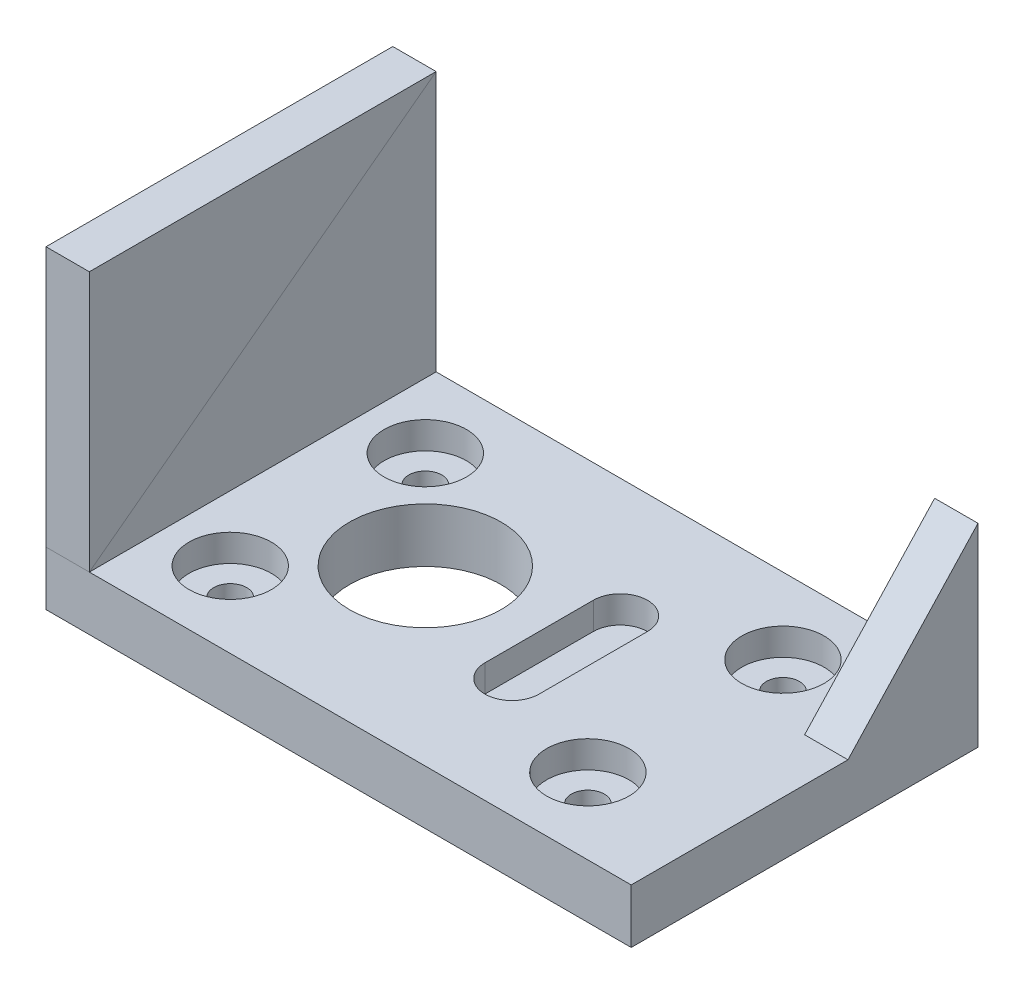
from build123d import *

# Parameters (mm, degrees)
SKETCH2_W           = 46
SKETCH2_H           = 32
SKETCH2_R           = 1.525
SKETCH2_R_2         = 7
BOSS_EXTRUDE1_DEPTH = 5
SKETCH3_R           = 3.8
CUT_EXTRUDE1_DEPTH  = 2.5
BOSS_EXTRUDE2_DEPTH = 87.8
BOSS_EXTRUDE3_START = 82.8
SKETCH2_2_W         = 46
SKETCH2_2_H         = 32
SKETCH2_2_R         = 1.525
SKETCH2_2_R_2       = 7
BOSS_EXTRUDE3_DEPTH = 5
CUT_EXTRUDE2_START  = 80.3
SKETCH3_3_R         = 3.8
CUT_EXTRUDE2_DEPTH  = 2.5
CUT_EXTRUDE3_DEPTH  = 5
CUT_EXTRUDE4_DEPTH  = 5
CUT_EXTRUDE5_DEPTH  = 66
BOSS_EXTRUDE5_DEPTH = 4


with BuildPart() as part:
    # Sketch2 → Boss-Extrude1 (new body)
    with BuildSketch(Plane(origin=(0, 0, 0), x_dir=(1, 0, 0), z_dir=(0, 1, 0))):
        Rectangle(SKETCH2_W, SKETCH2_H)
        with Locations(Location((-17, 9, 0), (0, 0, 270))):
            Circle(SKETCH2_R, mode=Mode.SUBTRACT)
        with Locations(Location((-17, -9, 0), (0, 0, 270))):
            Circle(SKETCH2_R, mode=Mode.SUBTRACT)
        with Locations(Location((16, -9, 0), (0, 0, 270))):
            Circle(SKETCH2_R, mode=Mode.SUBTRACT)
        with Locations(Location((16, 9, 0), (0, 0, 270))):
            Circle(SKETCH2_R, mode=Mode.SUBTRACT)
        with Locations(Location((-8, 0, 0), (0, 0, 270))):
            Circle(SKETCH2_R_2, mode=Mode.SUBTRACT)
    extrude(amount=BOSS_EXTRUDE1_DEPTH)

    # Sketch3 → Cut-Extrude1 (cut)
    with BuildSketch(Plane(origin=(0, 5, 0), x_dir=(1, 0, 0), z_dir=(0, 1, 0))):
        with Locations(Location((-17, 9, 0), (0, 0, 270))):
            Circle(SKETCH3_R)
        with Locations(Location((-17, -9, 0), (0, 0, 270))):
            Circle(SKETCH3_R)
        with Locations(Location((16, -9, 0), (0, 0, 270))):
            Circle(SKETCH3_R)
        with Locations(Location((16, 9, 0), (0, 0, 270))):
            Circle(SKETCH3_R)
        with BuildLine():
            Line((7.5, 5), (7.5, -5))
            ThreePointArc((7.5, -5), (5, -7.5), (2.5, -5))
            Line((2.5, -5), (2.5, 5))
            ThreePointArc((2.5, 5), (5, 7.5), (7.5, 5))
        make_face()
    extrude(amount=-CUT_EXTRUDE1_DEPTH, mode=Mode.SUBTRACT)

    # Sketch4 → Boss-Extrude2 (add)
    with BuildSketch(Plane(origin=(0, 0, 0), x_dir=(-1, 0, 0), z_dir=(0, -1, 0))):
        Polygon((23, 16), (-23, 16), (-23, -16), (-27, -16), (-27, 18.5), (27, 18.5), (27, -16), (23, -16), align=None)
    extrude(amount=-BOSS_EXTRUDE2_DEPTH)

    # Sketch2<2> → Boss-Extrude3 (add)
    with BuildSketch(Plane(origin=(0, 0, 0), x_dir=(1, 0, 0), z_dir=(0, 1, 0)).offset(BOSS_EXTRUDE3_START)):
        Rectangle(SKETCH2_2_W, SKETCH2_2_H)
        with Locations(Location((-17, 9, 0), (0, 0, 270))):
            Circle(SKETCH2_2_R, mode=Mode.SUBTRACT)
        with Locations(Location((-17, -9, 0), (0, 0, 270))):
            Circle(SKETCH2_2_R, mode=Mode.SUBTRACT)
        with Locations(Location((16, -9, 0), (0, 0, 270))):
            Circle(SKETCH2_2_R, mode=Mode.SUBTRACT)
        with Locations(Location((16, 9, 0), (0, 0, 270))):
            Circle(SKETCH2_2_R, mode=Mode.SUBTRACT)
        with Locations(Location((-8, 0, 0), (0, 0, 270))):
            Circle(SKETCH2_2_R_2, mode=Mode.SUBTRACT)
    extrude(amount=BOSS_EXTRUDE3_DEPTH)

    # Sketch3<3> → Cut-Extrude2 (cut)
    with BuildSketch(Plane(origin=(0, 5, 0), x_dir=(1, 0, 0), z_dir=(0, 1, 0)).offset(CUT_EXTRUDE2_START)):
        with Locations(Location((-17, 9, 0), (0, 0, 270))):
            Circle(SKETCH3_3_R)
        with Locations(Location((-17, -9, 0), (0, 0, 270))):
            Circle(SKETCH3_3_R)
        with Locations(Location((16, -9, 0), (0, 0, 270))):
            Circle(SKETCH3_3_R)
        with Locations(Location((16, 9, 0), (0, 0, 270))):
            Circle(SKETCH3_3_R)
        with BuildLine():
            Line((7.5, 5), (7.5, -5))
            ThreePointArc((7.5, -5), (5, -7.5), (2.5, -5))
            Line((2.5, -5), (2.5, 5))
            ThreePointArc((2.5, 5), (5, 7.5), (7.5, 5))
        make_face()
    extrude(amount=-CUT_EXTRUDE2_DEPTH, mode=Mode.SUBTRACT)

    # Sketch5 → Cut-Extrude3 (cut)
    with BuildSketch(Plane(origin=(27, 0, 0), x_dir=(0, 0, -1), z_dir=(1, 0, 0))):
        Polygon((-16, 43.9), (-16, 5), (4, 5), (16, 17.9), (16, 43.9), align=None)
        Polygon((-16, 82.8), (-16, 43.9), (16, 43.9), (16, 73.9), (7, 82.8), align=None)
    extrude(amount=-CUT_EXTRUDE3_DEPTH, mode=Mode.SUBTRACT)

    # Sketch6 → Cut-Extrude4 (cut)
    with BuildSketch(Plane.ZY.offset(27)):
        Polygon((16, 82.8), (16, 5), (-16, 29), (-16, 58.8), align=None)
    extrude(amount=-CUT_EXTRUDE4_DEPTH, mode=Mode.SUBTRACT)

    # Sketch7 → Cut-Extrude5 (cut)
    with BuildSketch(Plane(origin=(27, 0, 0), x_dir=(0, 0, -1), z_dir=(1, 0, 0))):
        Polygon((16, 45.9), (16, 58.8), (-16, 82.8), (-16, 87.8), (18.5, 87.8), (18.5, 0), (16, 0), align=None)
    extrude(amount=-CUT_EXTRUDE5_DEPTH, mode=Mode.SUBTRACT)


with BuildPart() as body_2:
    # Sketch9 → Boss-Extrude5 (new body)
    with BuildSketch(Plane.ZY.offset(27)):
        Polygon((16, 5), (-16, 29), (16, 29), align=None)
    extrude(amount=-BOSS_EXTRUDE5_DEPTH)


solid = Compound([part.part, body_2.part])
